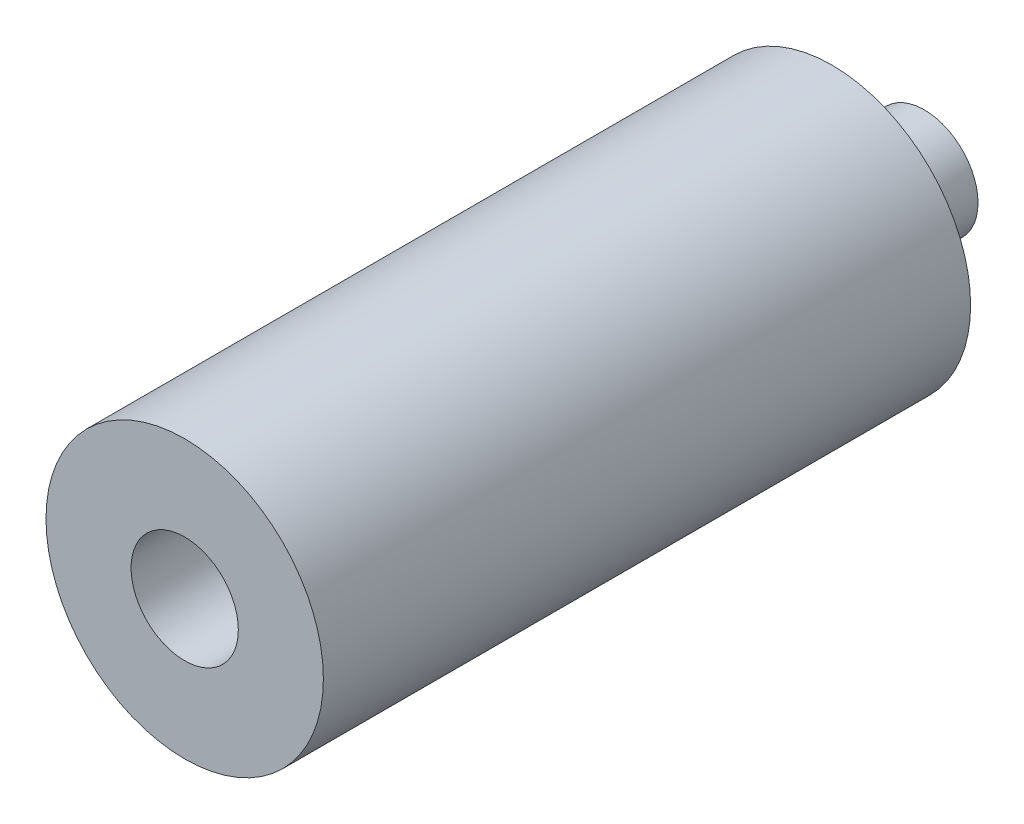
from build123d import *

# Parameters (mm, degrees)
SKETCH1_R           = 7.5
SKETCH1_R_2         = 2.9
BOSS_EXTRUDE1_DEPTH = 35
BOSS_EXTRUDE2_START = -5
SKETCH1_3_R         = 2.9
BOSS_EXTRUDE2_DEPTH = 5


with BuildPart() as part:
    # Sketch1 → Boss-Extrude1 (new body)
    with BuildSketch(Plane.XY):
        Circle(SKETCH1_R)
        Circle(SKETCH1_R_2, mode=Mode.SUBTRACT)
    extrude(amount=BOSS_EXTRUDE1_DEPTH)


with BuildPart() as body_2:
    # Sketch1<3> → Boss-Extrude2 (new body)
    with BuildSketch(Plane.XY.offset(BOSS_EXTRUDE2_START)):
        Circle(SKETCH1_3_R)
    extrude(amount=BOSS_EXTRUDE2_DEPTH)


solid = Compound([part.part, body_2.part])
